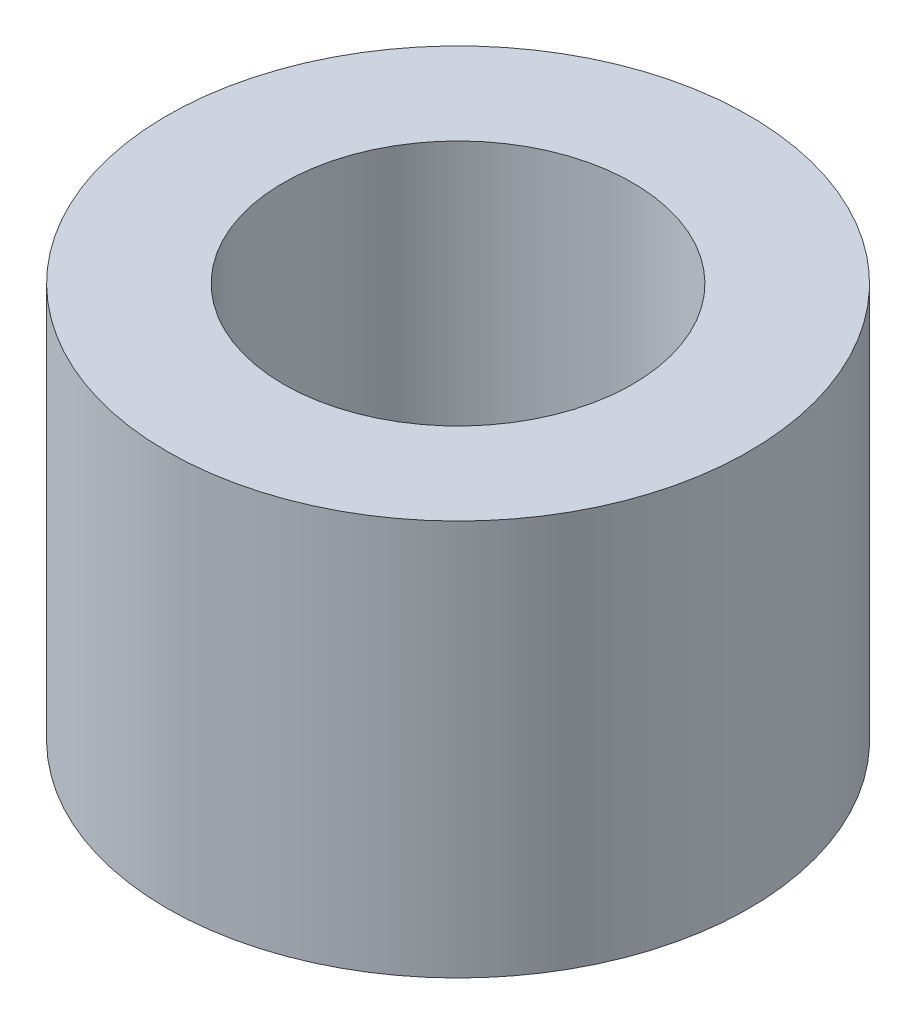
from build123d import *

# Parameters (mm, degrees)
SKETCH_1_R      = 2.5
SKETCH_1_R_2    = 1.5
EXTRUDE_1_DEPTH = 3.4


with BuildPart() as part:
    # 草图1 → 凸台-拉伸1 (new body)
    with BuildSketch(Plane(origin=(0, 0, 0), x_dir=(1, 0, 0), z_dir=(0, 1, 0))):
        with Locations(Location((0, 0, 0), (0, 0, 270))):
            Circle(SKETCH_1_R)
        with Locations(Location((0, 0, 0), (0, 0, 270))):
            Circle(SKETCH_1_R_2, mode=Mode.SUBTRACT)
    extrude(amount=EXTRUDE_1_DEPTH)


solid = part.part
